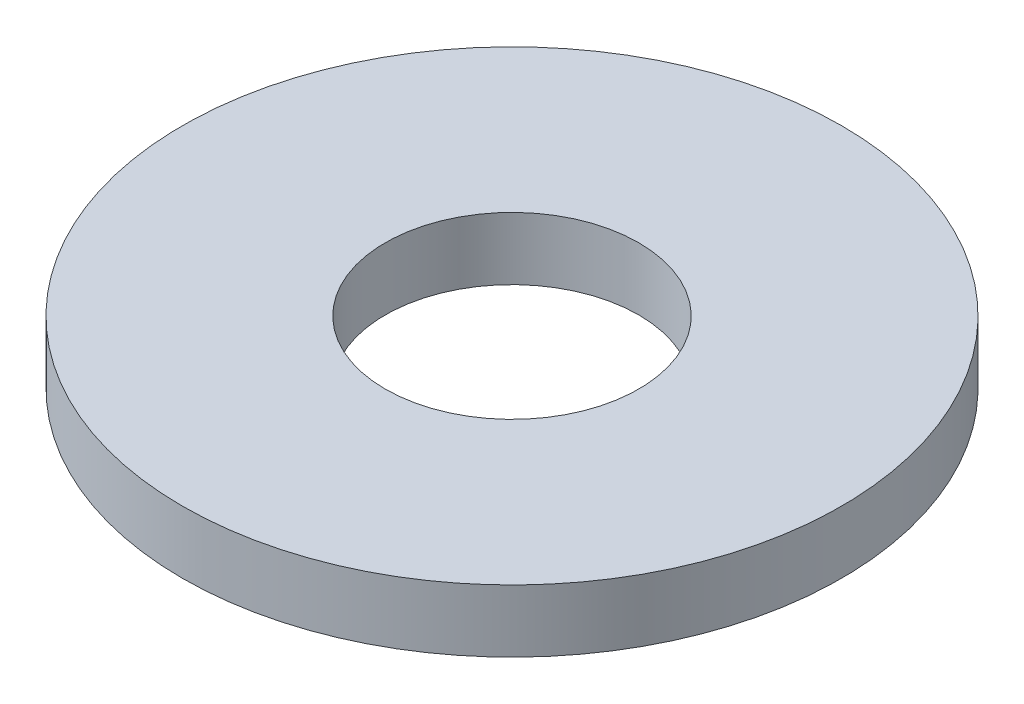
from build123d import *

# Parameters (mm, degrees)
ESQUISSE1_R        = 3.9
ESQUISSE1_R_2      = 1.5
BOSS_EXTRU_1_DEPTH = 0.74


with BuildPart() as part:
    # Esquisse1 → Boss.-Extru.1 (new body)
    with BuildSketch(Plane(origin=(0, 0, 0), x_dir=(1, 0, 0), z_dir=(0, 1, 0))):
        with Locations(Location((0, 0, 0), (0, 0, 270))):
            Circle(ESQUISSE1_R)
        with Locations(Location((0, 0, 0), (0, 0, 270))):
            Circle(ESQUISSE1_R_2, mode=Mode.SUBTRACT)
    extrude(amount=BOSS_EXTRU_1_DEPTH)


solid = part.part
